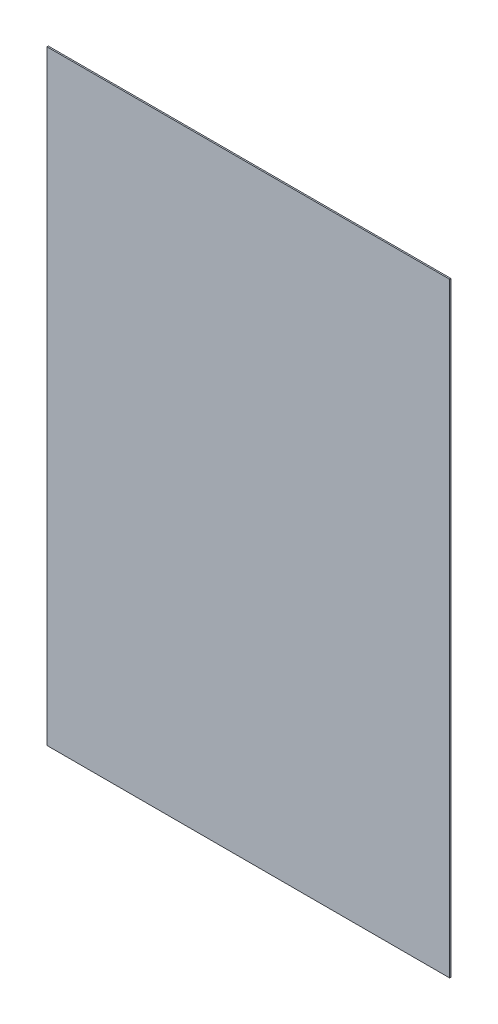
from build123d import *

# Parameters (mm, degrees)
ESQUISSE1_W        = 296.372398104
ESQUISSE1_H        = 445.323132384
BOSS_EXTRU_1_DEPTH = 1


with BuildPart() as part:
    # Esquisse1 → Boss.-Extru.1 (new body)
    with BuildSketch(Plane.XY):
        Rectangle(ESQUISSE1_W, ESQUISSE1_H)
    extrude(amount=BOSS_EXTRU_1_DEPTH)


solid = part.part
